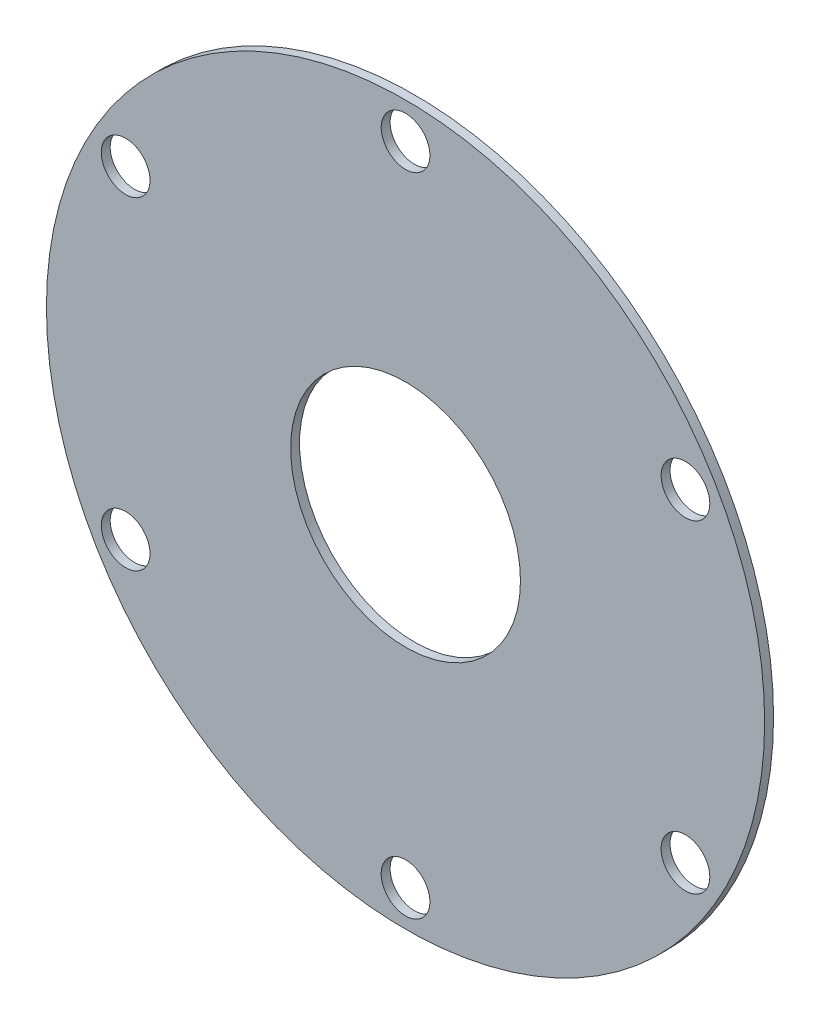
from build123d import *

# Parameters (mm, degrees)
SKETCH1_R             = 31.75
SKETCH1_R_2           = 10.16
BOSS_EXTRUDE1_DEPTH   = 0.7874
F_8_CLEARANCE_HOLE1_D = 4.3053


with BuildPart() as part:
    # Sketch1 → Boss-Extrude1 (new body)
    with BuildSketch(Plane.XY):
        Circle(SKETCH1_R)
        Circle(SKETCH1_R_2, mode=Mode.SUBTRACT)
    extrude(amount=BOSS_EXTRUDE1_DEPTH)

    # #8 Clearance Hole1 (through all)
    with Locations(Plane.XY.offset(0.7874)):
        with Locations((0, 28.575), (24.746675913, 14.2875), (24.746675913, -14.2875), (0, -28.575), (-24.746675913, -14.2875), (-24.746675913, 14.2875)):
            Hole(F_8_CLEARANCE_HOLE1_D / 2)


solid = part.part
